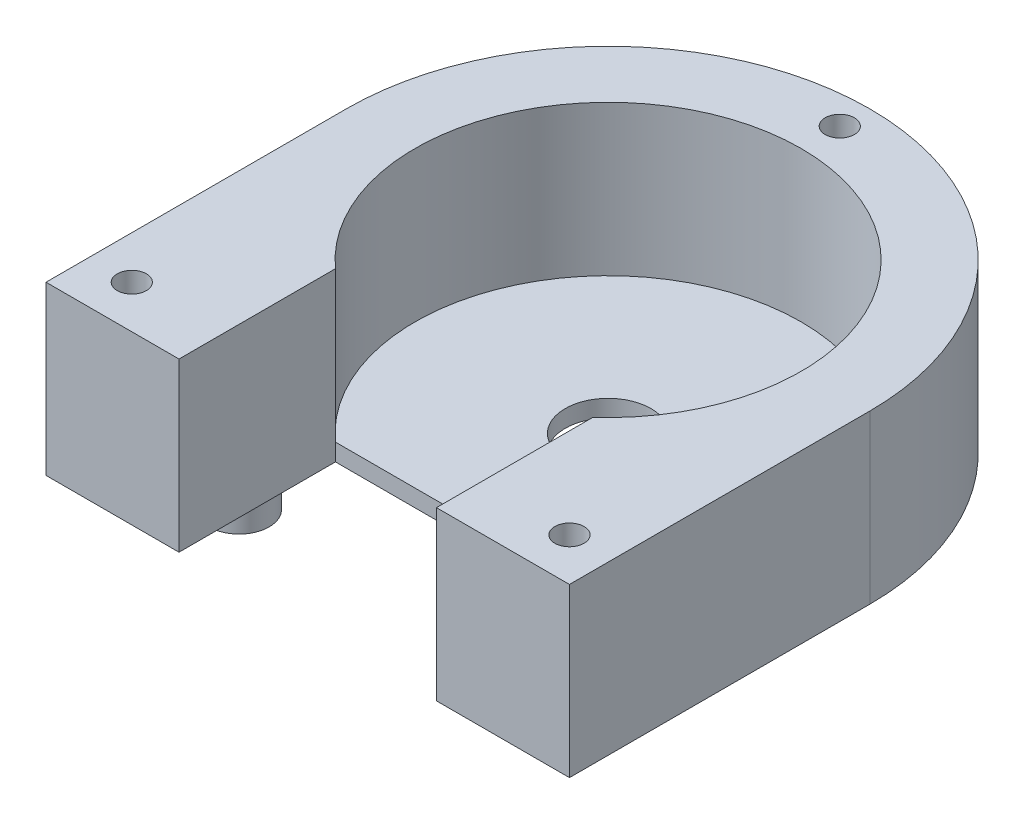
from build123d import *
from build123d.topology import SkipClean

# Parameters (mm, degrees)
BOSS_EXTRUDE1_DEPTH            = 17.5
SKETCH2_R                      = 5
BOSS_EXTRUDE2_DEPTH            = 2
SKETCH3_R                      = 3.5
SKETCH3_R_2                    = 1.6
BOSS_EXTRUDE3_DEPTH            = 4.2
CBORE_FOR_M3_SHCS1_D           = 3.4
CBORE_FOR_M3_SHCS1_DEPTH       = 19.5
CBORE_FOR_M3_SHCS1_CBORE_D     = 6.5
CBORE_FOR_M3_SHCS1_CBORE_DEPTH = 3
CBORE_FOR_M3_SHCS1_TIP         = 1.021463052


with BuildPart() as part:
    # Sketch1 → Boss-Extrude1 (new body)
    with BuildSketch(Plane(origin=(0, 0, 0), x_dir=(1, 0, 0), z_dir=(0, 1, 0))):
        with BuildLine():
            Line((-15, -26.55654345), (-15, -16.770509831))
            ThreePointArc((-15, -16.770509831), (-9.185586535, 20.539595906), (22.5, 0))
            ThreePointArc((22.5, 0), (20.539595906, -9.185586535), (15, -16.770509831))
            Line((15, -16.770509831), (15, -26.55654345))
            ThreePointArc((15, -26.55654345), (26.34150717, -15.374491862), (30.5, 0))
            ThreePointArc((30.5, 0), (0, 30.5), (-30.5, 0))
            ThreePointArc((-30.5, 0), (-26.34150717, -15.374491862), (-15, -26.55654345))
        make_face()
        with BuildLine():
            Line((-15, -35), (-15, -26.55654345))
            ThreePointArc((-15, -26.55654345), (-26.34150717, -15.374491862), (-30.5, 0))
            Line((-30.5, 0), (-30.5, -35))
            Line((-30.5, -35), (-15, -35))
        make_face()
        with BuildLine():
            ThreePointArc((30.5, 0), (26.34150717, -15.374491862), (15, -26.55654345))
            Line((15, -26.55654345), (15, -35))
            Line((15, -35), (30.5, -35))
            Line((30.5, -35), (30.5, 0))
        make_face()
    extrude(amount=-BOSS_EXTRUDE1_DEPTH)

    # Sketch2 → Boss-Extrude2 (add)
    # profile 1 of 2: a face of its own
    with SkipClean():  # the faces are left unmerged after this step: merging them gives an invalid solid
        with BuildSketch(Plane.XZ.offset(17.5)):
            with BuildLine():
                Line((-15, 16.770509831), (15, 16.770509831))
                ThreePointArc((15, 16.770509831), (0, -22.5), (-15, 16.770509831))
            make_face()
            with Locations(Location((0, 0, 0), (0, 0, 270))):
                Circle(SKETCH2_R, mode=Mode.SUBTRACT)
        # profile 2 of 2: a face of its own
        with BuildSketch(Plane.XZ.offset(17.5)):
            with BuildLine():
                Line((30.5, 35), (15, 35))
                Line((15, 35), (15, 16.770509831))
                ThreePointArc((15, 16.770509831), (0, -22.5), (-15, 16.770509831))
                Line((-15, 16.770509831), (-15, 35))
                Line((-15, 35), (-30.5, 35))
                Line((-30.5, 35), (-30.5, 0))
                ThreePointArc((-30.5, 0), (0, -30.5), (30.5, 0))
                Line((30.5, 0), (30.5, 35))
            make_face()
        extrude(amount=BOSS_EXTRUDE2_DEPTH)

    # Sketch3 → Boss-Extrude3 (add)
    # profile 1 of 4: a face of its own
    with SkipClean():  # the faces are left unmerged after this step: merging them gives an invalid solid
        with BuildSketch(Plane.XZ.offset(19.5)):
            with Locations(Location((-20, 23, 0), (0, 0, 270))):
                Circle(SKETCH3_R)
            with Locations(Location((-20, 23, 0), (0, 0, 270))):
                Circle(SKETCH3_R_2, mode=Mode.SUBTRACT)
        # profile 2 of 4: a face of its own
        with BuildSketch(Plane.XZ.offset(19.5)):
            with Locations(Location((20, 23, 0), (0, 0, 270))):
                Circle(SKETCH3_R)
            with Locations(Location((20, 23, 0), (0, 0, 270))):
                Circle(SKETCH3_R_2, mode=Mode.SUBTRACT)
        # profile 3 of 4: a face of its own
        with BuildSketch(Plane.XZ.offset(19.5)):
            with Locations(Location((20, -15, 0), (0, 0, 270))):
                Circle(SKETCH3_R)
            with Locations(Location((20, -15, 0), (0, 0, 270))):
                Circle(SKETCH3_R_2, mode=Mode.SUBTRACT)
        # profile 4 of 4: a face of its own
        with BuildSketch(Plane.XZ.offset(19.5)):
            with Locations(Location((-20, -15, 0), (0, 0, 270))):
                Circle(SKETCH3_R)
            with Locations(Location((-20, -15, 0), (0, 0, 270))):
                Circle(SKETCH3_R_2, mode=Mode.SUBTRACT)
        extrude(amount=BOSS_EXTRUDE3_DEPTH)

    # CBORE for M3 SHCS1
    with Locations(Plane.XZ.offset(19.5)):
        with Locations((0, -27), (25.5, 30), (-25.5, 30)):
            CounterBoreHole(CBORE_FOR_M3_SHCS1_D / 2, CBORE_FOR_M3_SHCS1_CBORE_D / 2, CBORE_FOR_M3_SHCS1_CBORE_DEPTH, depth=CBORE_FOR_M3_SHCS1_DEPTH)
            with Locations((0, 0, -(CBORE_FOR_M3_SHCS1_DEPTH + CBORE_FOR_M3_SHCS1_TIP / 2))):  # 118° drill point
                Cone(0, CBORE_FOR_M3_SHCS1_D / 2, CBORE_FOR_M3_SHCS1_TIP, mode=Mode.SUBTRACT)


solid = part.part
